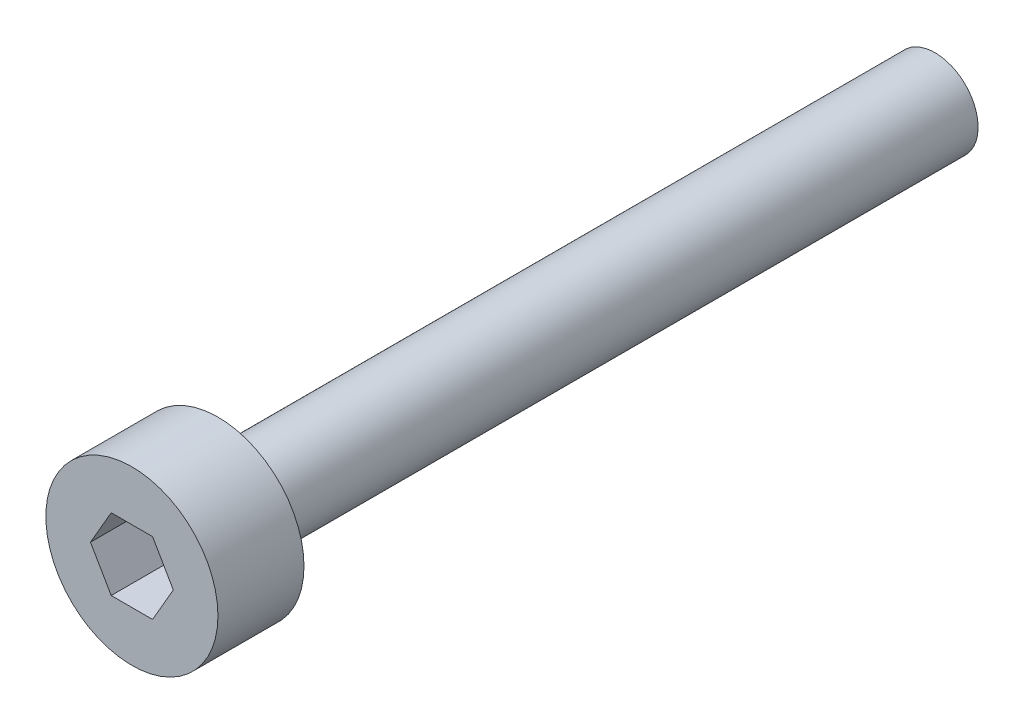
from build123d import *

# Parameters (mm, degrees)
SKETCH_5_R          = 3
EXTRUDE_1_DEPTH     = 3
CUT_EXTRUDE_1_DEPTH = 2
SKETCH_7_R          = 1.5
EXTRUDE_2_DEPTH     = 25


with BuildPart() as part:
    # ｽｹｯﾁ5 → ﾎﾞｽ - 押し出し1 (new body)
    with BuildSketch(Plane.XY):
        Circle(SKETCH_5_R)
    extrude(amount=EXTRUDE_1_DEPTH)

    # ｽｹｯﾁ6 → ｶｯﾄ - 押し出し1 (cut)
    with BuildSketch(Plane.XY.offset(3)):
        Polygon((1.443375673, 0), (0.721687836, 1.25), (-0.721687836, 1.25), (-1.443375673, 0), (-0.721687836, -1.25), (0.721687836, -1.25), align=None)
    extrude(amount=-CUT_EXTRUDE_1_DEPTH, mode=Mode.SUBTRACT)

    # ｽｹｯﾁ7 → ﾎﾞｽ - 押し出し2 (add)
    with BuildSketch(Plane(origin=(0, 0, 0), x_dir=(-1, 0, 0), z_dir=(0, 0, -1))):
        Circle(SKETCH_7_R)
    extrude(amount=EXTRUDE_2_DEPTH)


solid = part.part
